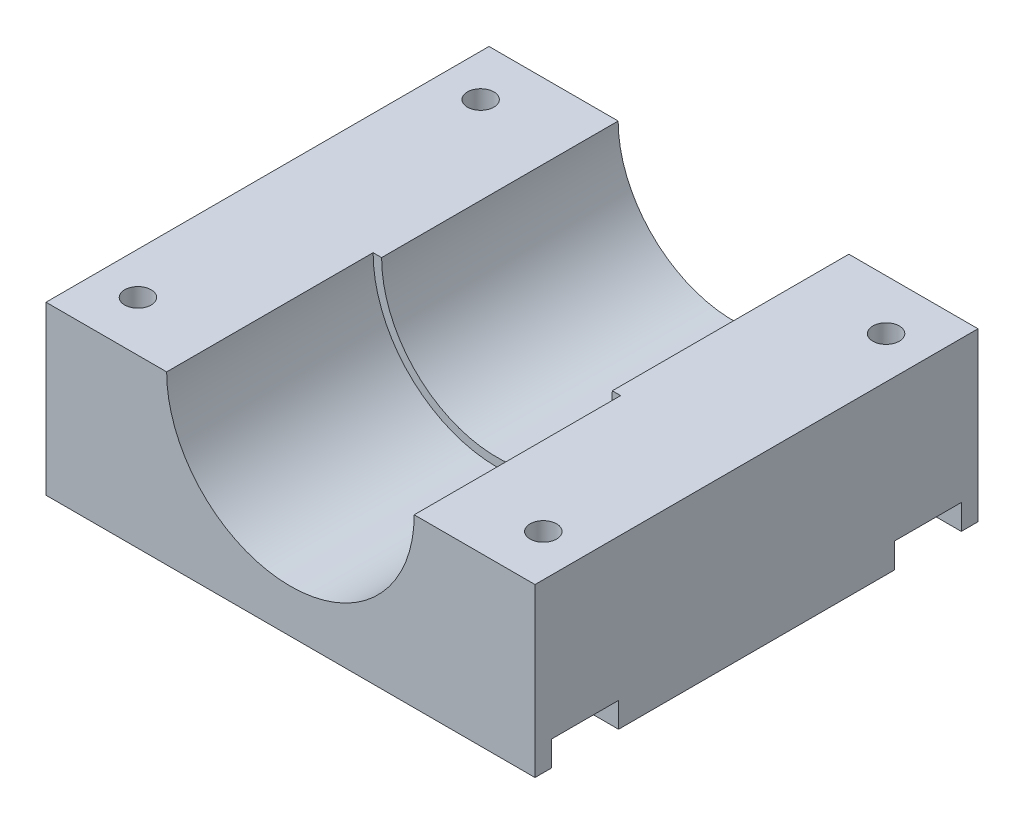
from build123d import *

# Parameters (mm, degrees)
SKETCH1_W                                  = 58.5
SKETCH1_H                                  = 20
BOSS_EXTRUDE1_DEPTH                        = 53
CUT_EXTRUDE2_DEPTH                         = 24.7
CUT_EXTRUDE3_DEPTH                         = 32.4
SKETCH8_W                                  = 10
SKETCH8_H                                  = 8
CUT_EXTRUDE6_DEPTH                         = 3
SKETCH7_R                                  = 1.585
CUT_EXTRUDE5_DEPTH                         = 92.5
MIRROR1_AT_THE_SECOND_PLANE_COPY_1_SKETC_W = 10
MIRROR1_AT_THE_SECOND_PLANE_COPY_1_SKETC_H = 8
MIRROR1_AT_THE_SECOND_PLANE_COPY_1_DEPTH   = 3


with BuildPart() as part:
    # Sketch1 → Boss-Extrude1 (new body)
    with BuildSketch(Plane.XY):
        with Locations((29.25, -3.609195402)):
            Rectangle(SKETCH1_W, SKETCH1_H)
    extrude(amount=BOSS_EXTRUDE1_DEPTH)

    # Sketch3 → Cut-Extrude2 (cut)
    with BuildSketch(Plane.XY.offset(53)):
        with BuildLine():
            Line((14.434183752, 6.390804598), (44.05, 6.390804598))
            ThreePointArc((44.05, 6.390804598), (29.242091876, -8.417103526), (14.434183752, 6.390804598))
        make_face()
    extrude(amount=-CUT_EXTRUDE2_DEPTH, mode=Mode.SUBTRACT)

    # Sketch5 → Cut-Extrude3 (cut)
    with BuildSketch(Plane(origin=(0, 0, 0), x_dir=(-1, 0, 0), z_dir=(0, 0, -1))):
        with BuildLine():
            Line((-43.05, 6.390804598), (-15.45, 6.390804598))
            ThreePointArc((-15.45, 6.390804598), (-29.25, -7.409195402), (-43.05, 6.390804598))
        make_face()
    extrude(amount=-CUT_EXTRUDE3_DEPTH, mode=Mode.SUBTRACT)

    # Sketch8 → Cut-Extrude6 (cut)
    with BuildSketch(Plane(origin=(0, -13.609195402, 0), x_dir=(-1, 0, 0), z_dir=(0, -1, 0))):
        with Locations((-53.5, -6)):
            Rectangle(SKETCH8_W, SKETCH8_H)
    cut_extrude6 = extrude(amount=-CUT_EXTRUDE6_DEPTH, mode=Mode.SUBTRACT)

    # Sketch7 → Cut-Extrude5 (cut)
    with BuildSketch(Plane(origin=(0, -13.609195402, 0), x_dir=(-1, 0, 0), z_dir=(0, -1, 0))):
        with Locations(Location((-53.5, -47, 0), (0, 0, 180))):
            Circle(SKETCH7_R)
        with Locations(Location((-53.5, -6, 0), (0, 0, 180))):
            Circle(SKETCH7_R)
        with Locations(Location((-5, -6, 0), (0, 0, 180))):
            Circle(SKETCH7_R)
        with Locations(Location((-5, -47, 0), (0, 0, 180))):
            Circle(SKETCH7_R)
    extrude(amount=-CUT_EXTRUDE5_DEPTH, mode=Mode.SUBTRACT)

    # Mirror1: Cut-Extrude6 across plane
    add(cut_extrude6.mirror(Plane.XY.offset(26.5)), mode=Mode.SUBTRACT)

    # Mirror1 at the second plane: Cut-Extrude6 across plane
    add(cut_extrude6.mirror(Plane.ZY.offset(-29.25)), mode=Mode.SUBTRACT)

    # Mirror1 at the second plane copy 1 sketc → Mirror1 at the second plane copy 1 (cut)
    with BuildSketch(Plane(origin=(58.5, -13.609195402, 53), x_dir=(1, 0, 0), z_dir=(0, -1, 0))):
        with Locations((-53.5, -6)):
            Rectangle(MIRROR1_AT_THE_SECOND_PLANE_COPY_1_SKETC_W, MIRROR1_AT_THE_SECOND_PLANE_COPY_1_SKETC_H)
    extrude(amount=-MIRROR1_AT_THE_SECOND_PLANE_COPY_1_DEPTH, mode=Mode.SUBTRACT)


solid = part.part
